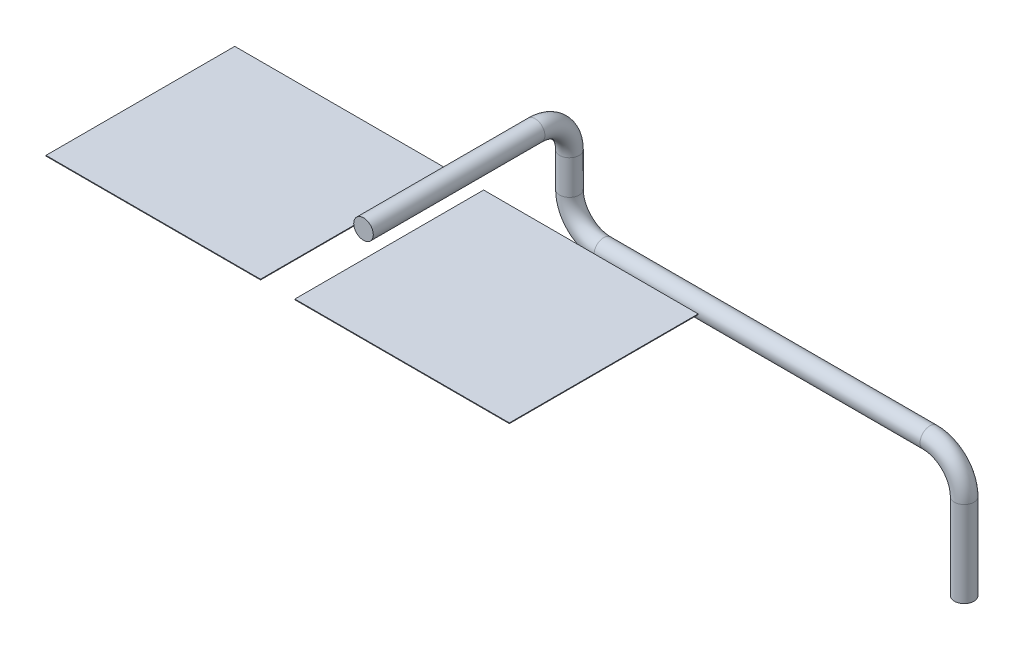
from build123d import *

# Parameters (mm, degrees)
SKETCH_1_W        = 12.5
SKETCH_1_H        = 11
EXTRUDE_1_DEPTH   = 0.04
EXTRUDE_1_2_DEPTH = 0.04
SKETCH_2_R        = 0.57
EXTRUDE_2_DEPTH   = 6
SKETCH_3_R        = 0.57
EXTRUDE_3_DEPTH   = 2
SKETCH_5_R        = 0.57


with BuildPart() as part:
    # Эскиз1 → Бобышка-Вытянуть1 (new body)
    with BuildSketch(Plane(origin=(0, 0, 0), x_dir=(1, 0, 0), z_dir=(0, 1, 0))):
        with Locations((6.25, 5.5)):
            Rectangle(SKETCH_1_W, SKETCH_1_H)
    extrude(amount=EXTRUDE_1_DEPTH)


with BuildPart() as body_2:
    # Эскиз1 → Extrude 1 2 (new body)
    with BuildSketch(Plane(origin=(0, 0, 0), x_dir=(1, 0, 0), z_dir=(0, 1, 0))):
        with Locations((20.75, 5.5)):
            Rectangle(SKETCH_1_W, SKETCH_1_H)
    extrude(amount=EXTRUDE_1_2_DEPTH)


with BuildPart() as body_3:
    # Эскиз2 → Бобышка-Вытянуть2 (new body)
    with BuildSketch(Plane(origin=(0, 0, -11), x_dir=(-1, 0, 0), z_dir=(0, 0, -1))):
        with Locations((-13.5, 0.57)):
            Circle(SKETCH_2_R)
    extrude(amount=-EXTRUDE_2_DEPTH)

    # Эскиз3 → Бобышка-Вытянуть3 (add)
    with BuildSketch(Plane(origin=(0, 0, -11), x_dir=(-1, 0, 0), z_dir=(0, 0, -1))):
        with Locations((-13.5, 0.57)):
            Circle(SKETCH_3_R)
    extrude(amount=EXTRUDE_3_DEPTH)

    # По траектории1: sweep along a curve in space
    with BuildLine() as sweep_1_path:
        Line((13.5, 0.57, -13), (13.5, 0.57, -15))
        ThreePointArc((13.5, -1.43, -17), (13.5, -0.015786438, -16.414213562), (13.5, 0.57, -15))
        Line((13.5, -1.43, -17), (13.5, -3.43, -17))
        ThreePointArc((15.5, -5.43, -17), (14.085786438, -4.844213562, -17), (13.5, -3.43, -17))
        Line((15.5, -5.43, -17), (34.5, -5.43, -17))
        ThreePointArc((36.5, -7.43, -17), (35.914213562, -6.015786438, -17), (34.5, -5.43, -17))
        Line((36.5, -7.43, -17), (36.5, -12.43, -17))
    # Эскиз5 → По траектории1 (sweep)
    with BuildSketch(Plane(origin=(0, 0, -13), x_dir=(-1, 0, 0), z_dir=(0, 0, -1))):
        with Locations((-13.5, 0.57)):
            Circle(SKETCH_5_R)
    sweep(path=sweep_1_path.line)


solid = Compound([part.part, body_2.part, body_3.part])
